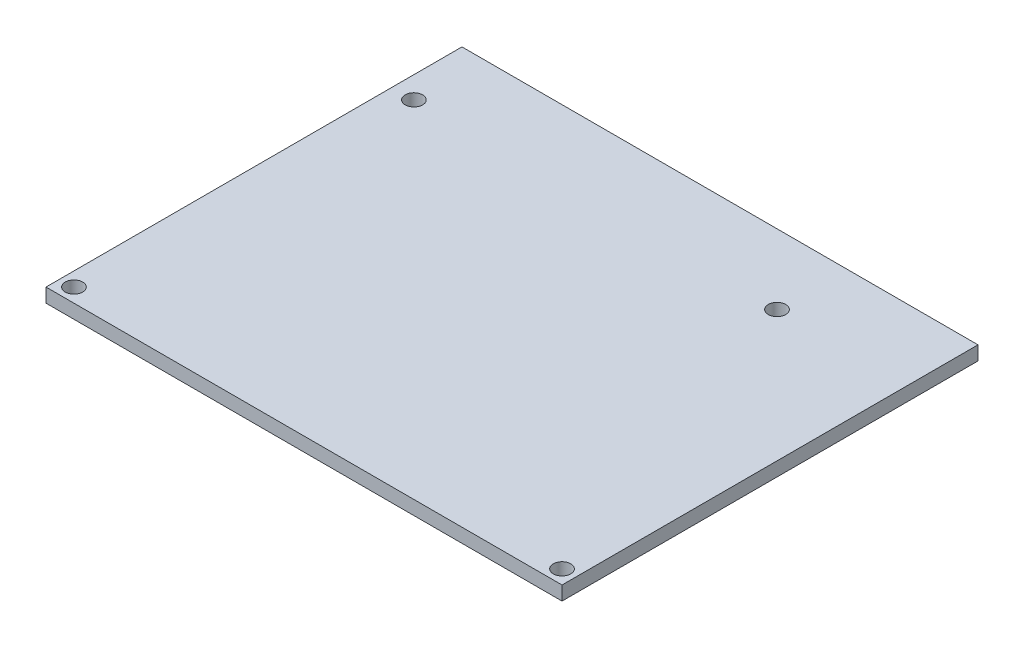
from build123d import *

# Parameters (mm, degrees)
SKETCH1_W           = 59.05
SKETCH1_H           = 47.6
SKETCH1_R           = 1
BOSS_EXTRUDE1_DEPTH = 1.6


with BuildPart() as part:
    # Sketch1 → Boss-Extrude1 (new body)
    with BuildSketch(Plane(origin=(0, 0, 0), x_dir=(1, 0, 0), z_dir=(0, 1, 0))):
        with Locations((29.525, 23.8)):
            Rectangle(SKETCH1_W, SKETCH1_H)
        with Locations(Location((57.45, 1.6, 0), (0, 0, 270))):
            Circle(SKETCH1_R, mode=Mode.SUBTRACT)
        with Locations(Location((44.05, 39.6, 0), (0, 0, 270))):
            Circle(SKETCH1_R, mode=Mode.SUBTRACT)
        with Locations(Location((2.5, 39.6, 0), (0, 0, 270))):
            Circle(SKETCH1_R, mode=Mode.SUBTRACT)
        with Locations(Location((1.6, 1.6, 0), (0, 0, 270))):
            Circle(SKETCH1_R, mode=Mode.SUBTRACT)
    extrude(amount=BOSS_EXTRUDE1_DEPTH)


solid = part.part
